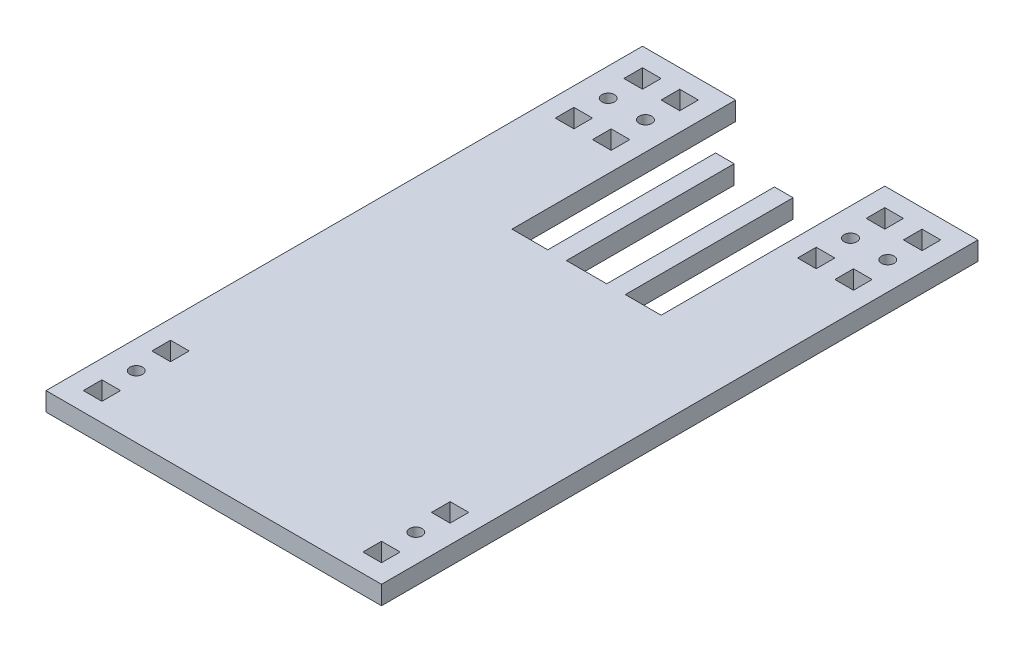
from build123d import *

# Parameters (mm, degrees)
SKETCH1_R           = 2.159
SKETCH1_W           = 6.35
SKETCH1_H           = 6.35
BOSS_EXTRUDE1_DEPTH = 6.35


with BuildPart() as part:
    # Sketch1 → Boss-Extrude1 (new body)
    with BuildSketch(Plane(origin=(0, 0, 0), x_dir=(1, 0, 0), z_dir=(0, 1, 0))):
        Polygon((-57.15, 101.6), (-25.4, 101.6), (-25.4, 25.4), (-13.208, 25.4), (-13.208, 82.55), (-6.858, 82.55), (-6.858, 25.4), (6.858, 25.4), (6.858, 82.55), (13.208, 82.55), (13.208, 25.4), (25.4, 25.4), (25.4, 101.6), (57.15, 101.6), (57.15, -101.6), (-57.15, -101.6), align=None)
        with Locations(Location((34.925, 80.391, 0), (0, 0, 270))):
            Circle(SKETCH1_R, mode=Mode.SUBTRACT)
        with Locations(Location((-34.925, 80.391, 0), (0, 0, 270))):
            Circle(SKETCH1_R, mode=Mode.SUBTRACT)
        with Locations(Location((47.625, 80.391, 0), (0, 0, 270))):
            Circle(SKETCH1_R, mode=Mode.SUBTRACT)
        with Locations(Location((-47.625, 80.391, 0), (0, 0, 270))):
            Circle(SKETCH1_R, mode=Mode.SUBTRACT)
        with Locations(Location((47.625, -80.391, 0), (0, 0, 270))):
            Circle(SKETCH1_R, mode=Mode.SUBTRACT)
        with Locations(Location((-47.625, -80.391, 0), (0, 0, 270))):
            Circle(SKETCH1_R, mode=Mode.SUBTRACT)
        with Locations((34.925, 92.075)):
            Rectangle(SKETCH1_W, SKETCH1_H, mode=Mode.SUBTRACT)
        with Locations((34.925, 68.707)):
            Rectangle(SKETCH1_W, SKETCH1_H, mode=Mode.SUBTRACT)
        with Locations((-34.925, 92.075)):
            Rectangle(SKETCH1_W, SKETCH1_H, mode=Mode.SUBTRACT)
        with Locations((-34.925, 68.707)):
            Rectangle(SKETCH1_W, SKETCH1_H, mode=Mode.SUBTRACT)
        with Locations((47.625, 92.075)):
            Rectangle(SKETCH1_W, SKETCH1_H, mode=Mode.SUBTRACT)
        with Locations((47.625, 68.707)):
            Rectangle(SKETCH1_W, SKETCH1_H, mode=Mode.SUBTRACT)
        with Locations((-47.625, 92.075)):
            Rectangle(SKETCH1_W, SKETCH1_H, mode=Mode.SUBTRACT)
        with Locations((-47.625, 68.707)):
            Rectangle(SKETCH1_W, SKETCH1_H, mode=Mode.SUBTRACT)
        with Locations((47.625, -68.707)):
            Rectangle(SKETCH1_W, SKETCH1_H, mode=Mode.SUBTRACT)
        with Locations((47.625, -92.075)):
            Rectangle(SKETCH1_W, SKETCH1_H, mode=Mode.SUBTRACT)
        with Locations((-47.625, -68.707)):
            Rectangle(SKETCH1_W, SKETCH1_H, mode=Mode.SUBTRACT)
        with Locations((-47.625, -92.075)):
            Rectangle(SKETCH1_W, SKETCH1_H, mode=Mode.SUBTRACT)
    extrude(amount=BOSS_EXTRUDE1_DEPTH)


solid = part.part
